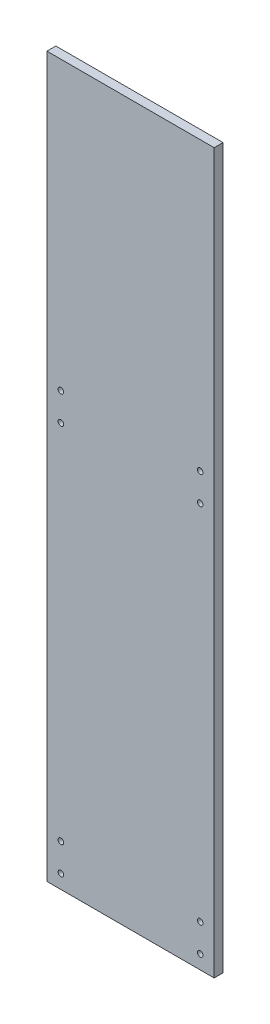
from build123d import *

# Parameters (mm, degrees)
MODEL_W             = 30
MODEL_H             = 129.000000068
MODEL_R             = 0.5
BOSS_EXTRUDE1_DEPTH = 1.6


with BuildPart() as part:
    # Model → Boss-Extrude1 (new body)
    with BuildSketch(Plane.XY):
        with Locations((174.879127707, 63.499999966)):
            Rectangle(MODEL_W, MODEL_H)
        with Locations((162.379127707, 6.499999932)):
            Circle(MODEL_R, mode=Mode.SUBTRACT)
        with Locations((162.379127707, 71.499999932)):
            Circle(MODEL_R, mode=Mode.SUBTRACT)
        with Locations((187.379127707, 6.499999932)):
            Circle(MODEL_R, mode=Mode.SUBTRACT)
        with Locations((187.379127707, 71.499999932)):
            Circle(MODEL_R, mode=Mode.SUBTRACT)
        with Locations((162.379127707, 76.499999932)):
            Circle(MODEL_R, mode=Mode.SUBTRACT)
        with Locations((187.379127707, 76.499999932)):
            Circle(MODEL_R, mode=Mode.SUBTRACT)
        with Locations((162.379127707, 1.499999932)):
            Circle(MODEL_R, mode=Mode.SUBTRACT)
        with Locations((187.379127707, 1.499999932)):
            Circle(MODEL_R, mode=Mode.SUBTRACT)
    extrude(amount=BOSS_EXTRUDE1_DEPTH)


solid = part.part
